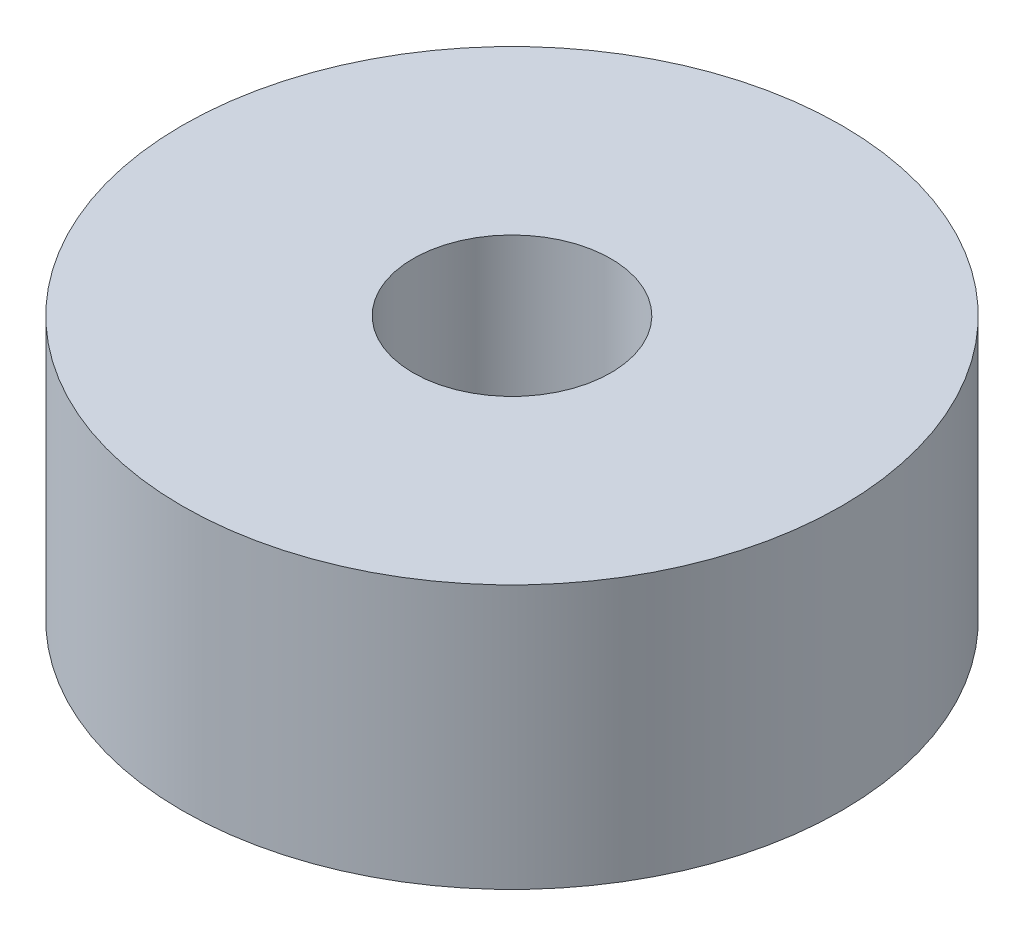
from build123d import *

# Parameters (mm, degrees)
SKETCH_1_R      = 5
SKETCH_1_R_2    = 1.5
EXTRUDE_1_DEPTH = 2


with BuildPart() as part:
    # 草图1 → 凸台-拉伸1 (new, symmetric)
    with BuildSketch(Plane(origin=(0, 0, 0), x_dir=(1, 0, 0), z_dir=(0, 1, 0))):
        with Locations(Location((0, 0, 0), (0, 0, 270))):
            Circle(SKETCH_1_R)
        with Locations(Location((0, 0, 0), (0, 0, 270))):
            Circle(SKETCH_1_R_2, mode=Mode.SUBTRACT)
    extrude(amount=EXTRUDE_1_DEPTH, both=True)


solid = part.part
